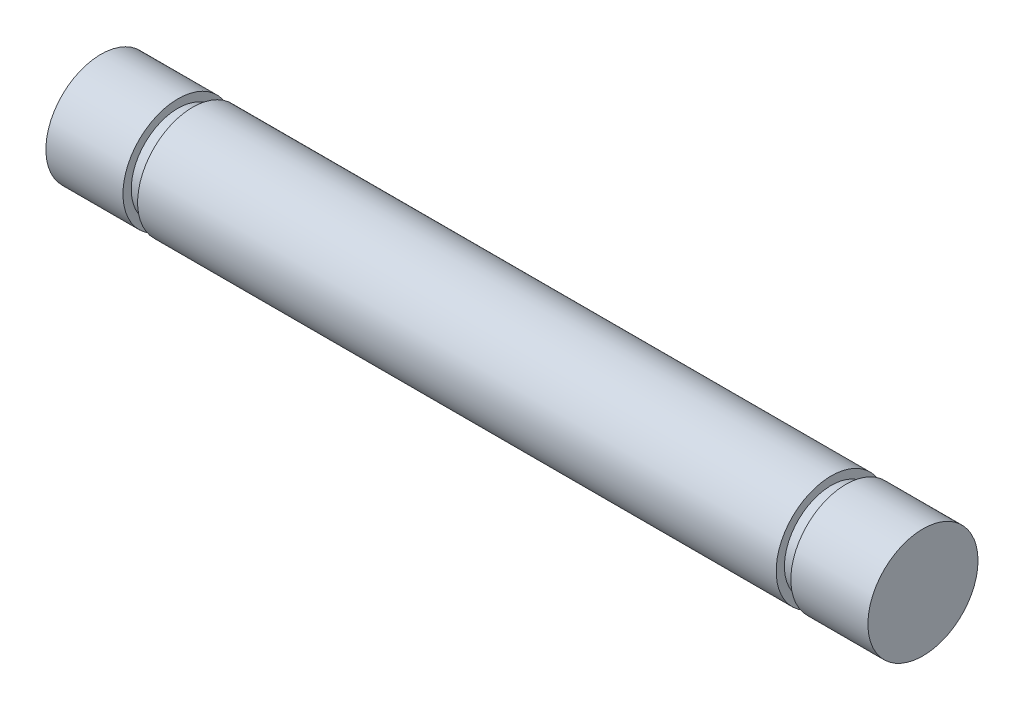
from build123d import *


with BuildPart() as part:
    # Croquis1 → Revolución1 (revolve)
    with BuildSketch(Plane(origin=(0, 0, 0), x_dir=(-1, 0, 0), z_dir=(0, 1, 0)), mode=Mode.PRIVATE) as revoluci_n1_sk:
        Polygon((-17.4, 3), (17.4, 3), (17.4, 2.55), (18.2, 2.55), (18.2, 3), (22.4, 3), (22.4, 0), (-22.4, 0), (-22.4, 3), (-18.2, 3), (-18.2, 2.55), (-17.4, 2.55), align=None)
    revolve(revoluci_n1_sk.sketch.rotate(Axis((22.4, 0, 0), (-1, 0, 0)), 180), axis=Axis((22.4, 0, 0), (-1, 0, 0)))


solid = part.part
